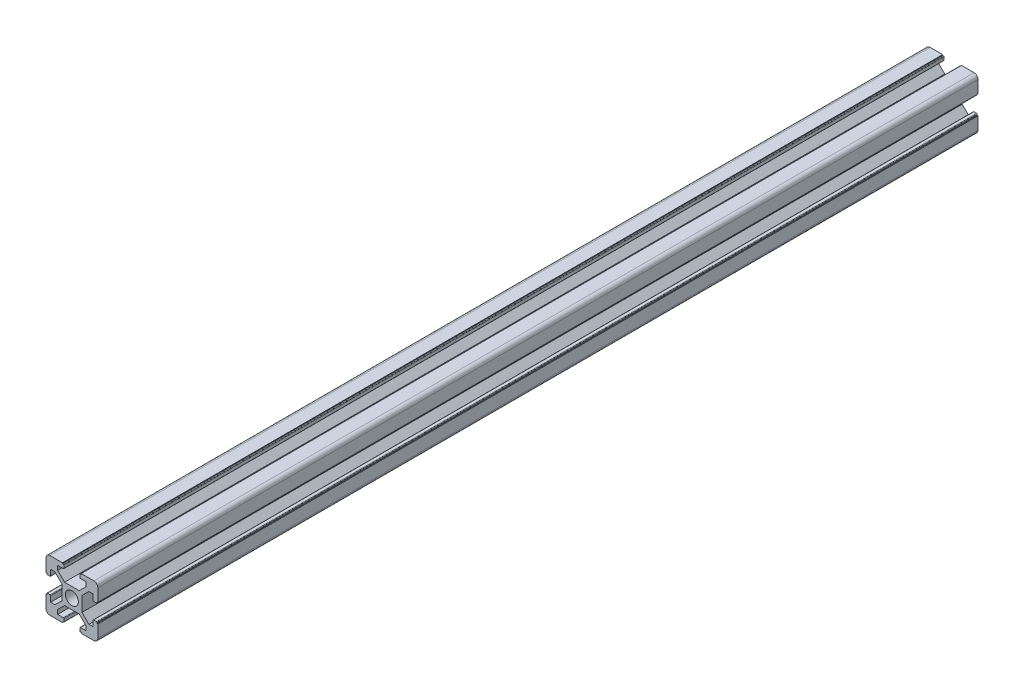
from build123d import *

# Parameters (mm, degrees)
SKETCH_1_R      = 2.5
EXTRUDE_2_DEPTH = 340
EXTRUDE_3_DEPTH = 340


with BuildPart() as part:
    # 草图1 → 凸台-拉伸2 (new body)
    with BuildSketch(Plane.XY):
        with BuildLine():
            Line((3.65, 10), (8.5, 10))
            ThreePointArc((8.5, 10), (9.560660172, 9.560660172), (10, 8.5))
            Line((10, 8.5), (10, 3.65))
            Line((10, 3.65), (8.2, 3.65))
            Line((8.2, 3.65), (8.2, 5.5))
            Line((8.2, 5.5), (6.560660172, 5.5))
            Line((6.560660172, 5.5), (3.9, 2.839339828))
            Line((3.9, 2.839339828), (3.9, -2.839339828))
            Line((3.9, -2.839339828), (6.560660172, -5.5))
            Line((6.560660172, -5.5), (8.2, -5.5))
            Line((8.2, -5.5), (8.2, -3.65))
            Line((8.2, -3.65), (10, -3.65))
            Line((10, -3.65), (10, -8.5))
            ThreePointArc((10, -8.5), (9.560660172, -9.560660172), (8.5, -10))
            Line((8.5, -10), (3.65, -10))
            Line((3.65, -10), (3.65, -8.2))
            Line((3.65, -8.2), (5.5, -8.2))
            Line((5.5, -8.2), (5.5, -6.560660172))
            Line((5.5, -6.560660172), (2.839339828, -3.9))
            Line((2.839339828, -3.9), (-2.839339828, -3.9))
            Line((-2.839339828, -3.9), (-5.5, -6.560660172))
            Line((-5.5, -6.560660172), (-5.5, -8.2))
            Line((-5.5, -8.2), (-3.65, -8.2))
            Line((-3.65, -8.2), (-3.65, -10))
            Line((-3.65, -10), (-8.5, -10))
            ThreePointArc((-8.5, -10), (-9.560660172, -9.560660172), (-10, -8.5))
            Line((-10, -8.5), (-10, -3.65))
            Line((-10, -3.65), (-8.2, -3.65))
            Line((-8.2, -3.65), (-8.2, -5.5))
            Line((-8.2, -5.5), (-6.560660172, -5.5))
            Line((-6.560660172, -5.5), (-3.9, -2.839339828))
            Line((-3.9, -2.839339828), (-3.9, 2.839339828))
            Line((-3.9, 2.839339828), (-6.560660172, 5.5))
            Line((-6.560660172, 5.5), (-8.2, 5.5))
            Line((-8.2, 5.5), (-8.2, 3.65))
            Line((-8.2, 3.65), (-10, 3.65))
            Line((-10, 3.65), (-10, 8.5))
            ThreePointArc((-10, 8.5), (-9.560660172, 9.560660172), (-8.5, 10))
            Line((-8.5, 10), (-3.65, 10))
            Line((-3.65, 10), (-3.65, 8.2))
            Line((-3.65, 8.2), (-5.5, 8.2))
            Line((-5.5, 8.2), (-5.5, 6.560660172))
            Line((-5.5, 6.560660172), (-2.839339828, 3.9))
            Line((-2.839339828, 3.9), (2.839339828, 3.9))
            Line((2.839339828, 3.9), (5.5, 6.560660172))
            Line((5.5, 6.560660172), (5.5, 8.2))
            Line((5.5, 8.2), (3.65, 8.2))
            Line((3.65, 8.2), (3.65, 10))
        make_face()
        Circle(SKETCH_1_R, mode=Mode.SUBTRACT)
    extrude(amount=EXTRUDE_2_DEPTH)

    # 草图3 → 凸台-拉伸3 (add)
    with BuildSketch(Plane.XY.offset(340)):
        with BuildLine():
            Line((-8.2, 3.65), (-9.7, 3.65))
            Line((-9.7, 3.65), (-9.7, 3.3))
            ThreePointArc((-9.7, 3.3), (-9.641421356, 3.158578644), (-9.5, 3.1))
            Line((-9.5, 3.1), (-8.4, 3.1))
            ThreePointArc((-8.4, 3.1), (-8.258578644, 3.158578644), (-8.2, 3.3))
            Line((-8.2, 3.3), (-8.2, 3.65))
        make_face()
        with BuildLine():
            Line((-3.65, 9.7), (-3.65, 8.2))
            Line((-3.65, 8.2), (-3.3, 8.2))
            ThreePointArc((-3.3, 8.2), (-3.158578644, 8.258578644), (-3.1, 8.4))
            Line((-3.1, 8.4), (-3.1, 9.5))
            ThreePointArc((-3.1, 9.5), (-3.158578644, 9.641421356), (-3.3, 9.7))
            Line((-3.3, 9.7), (-3.65, 9.7))
        make_face()
        with BuildLine():
            Line((3.65, 8.2), (3.65, 9.7))
            Line((3.65, 9.7), (3.3, 9.7))
            ThreePointArc((3.3, 9.7), (3.158578644, 9.641421356), (3.1, 9.5))
            Line((3.1, 9.5), (3.1, 8.4))
            ThreePointArc((3.1, 8.4), (3.158578644, 8.258578644), (3.3, 8.2))
            Line((3.3, 8.2), (3.65, 8.2))
        make_face()
        with BuildLine():
            Line((9.7, 3.65), (8.2, 3.65))
            Line((8.2, 3.65), (8.2, 3.3))
            ThreePointArc((8.2, 3.3), (8.258578644, 3.158578644), (8.4, 3.1))
            Line((8.4, 3.1), (9.5, 3.1))
            ThreePointArc((9.5, 3.1), (9.641421356, 3.158578644), (9.7, 3.3))
            Line((9.7, 3.3), (9.7, 3.65))
        make_face()
        with BuildLine():
            Line((3.65, -9.7), (3.65, -8.2))
            Line((3.65, -8.2), (3.3, -8.2))
            ThreePointArc((3.3, -8.2), (3.158578644, -8.258578644), (3.1, -8.4))
            Line((3.1, -8.4), (3.1, -9.5))
            ThreePointArc((3.1, -9.5), (3.158578644, -9.641421356), (3.3, -9.7))
            Line((3.3, -9.7), (3.65, -9.7))
        make_face()
        with BuildLine():
            Line((-3.65, -8.2), (-3.65, -9.7))
            Line((-3.65, -9.7), (-3.3, -9.7))
            ThreePointArc((-3.3, -9.7), (-3.158578644, -9.641421356), (-3.1, -9.5))
            Line((-3.1, -9.5), (-3.1, -8.4))
            ThreePointArc((-3.1, -8.4), (-3.158578644, -8.258578644), (-3.3, -8.2))
            Line((-3.3, -8.2), (-3.65, -8.2))
        make_face()
        with BuildLine():
            Line((8.2, -3.65), (8.2, -3.3))
            ThreePointArc((8.2, -3.3), (8.258578644, -3.158578644), (8.4, -3.1))
            Line((8.4, -3.1), (9.5, -3.1))
            ThreePointArc((9.5, -3.1), (9.641421356, -3.158578644), (9.7, -3.3))
            Line((9.7, -3.3), (9.7, -3.65))
            Line((9.7, -3.65), (8.2, -3.65))
        make_face()
        with BuildLine():
            Line((-8.2, -3.65), (-8.2, -3.3))
            ThreePointArc((-8.2, -3.3), (-8.258578644, -3.158578644), (-8.4, -3.1))
            Line((-8.4, -3.1), (-9.5, -3.1))
            ThreePointArc((-9.5, -3.1), (-9.641421356, -3.158578644), (-9.7, -3.3))
            Line((-9.7, -3.3), (-9.7, -3.65))
            Line((-9.7, -3.65), (-8.2, -3.65))
        make_face()
    extrude(amount=-EXTRUDE_3_DEPTH)


solid = part.part
